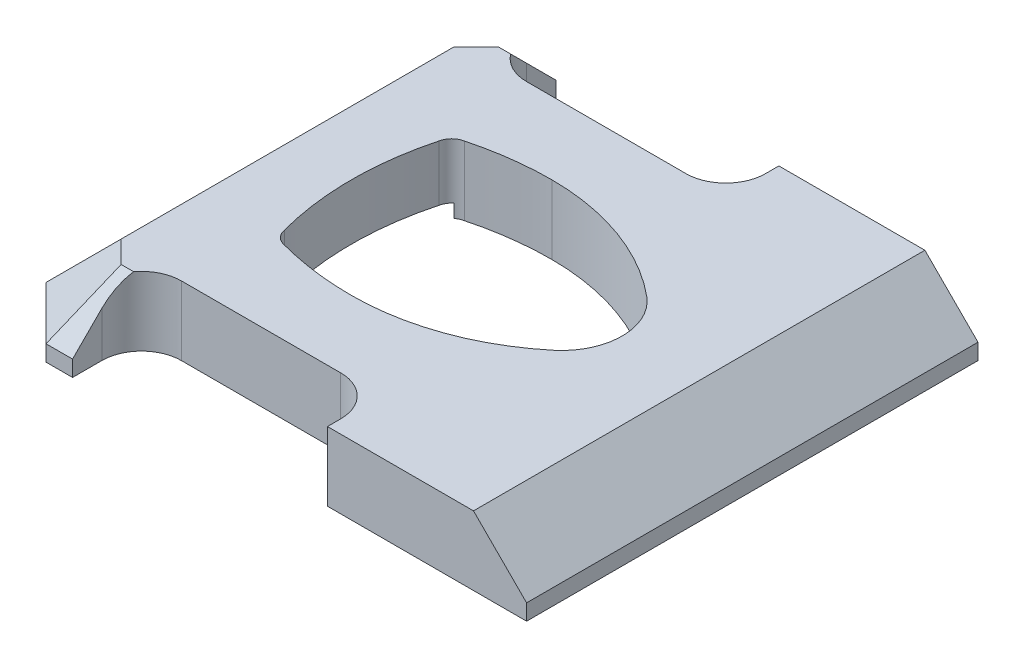
from build123d import *

# Parameters (mm, degrees)
SKETCH1_W           = 195
SKETCH1_H           = 170
BOSS_EXTRUDE1_DEPTH = 26
SKETCH2_W           = 90
SKETCH2_H           = 20
CUT_EXTRUDE1_DEPTH  = 132.936537775
FILLET1_R           = 15
SKETCH3_W           = 30
SKETCH3_H           = 6
BOSS_EXTRUDE2_DEPTH = 26
CHAMFER1_SIZE       = 20
CHAMFER2_SIZE       = 20
CHAMFER3_SIZE       = 20
SKETCH6_R           = 6.1
CUT_EXTRUDE4_DEPTH  = 3.2
FILLET2_R           = 0.2
CUT_EXTRUDE3_DEPTH  = 23
CUT_EXTRUDE5_DEPTH  = 136.879542242
SKETCH8_W           = 5
SKETCH8_H           = 76.6
BOSS_EXTRUDE3_DEPTH = 7
SKETCH9_W           = 10
SKETCH9_H           = 106.6
CUT_EXTRUDE6_DEPTH  = 5
SKETCH10_W          = 3
SKETCH10_H          = 106.6
CUT_EXTRUDE7_DEPTH  = 20
BOSS_EXTRUDE8_REACH = 166.014
SKETCH14_W          = 6
SKETCH14_H          = 16.5
CUT_EXTRUDE9_DEPTH  = 0.5
SKETCH15_W          = 5
SKETCH15_H          = 23.6
CUT_EXTRUDE10_DEPTH = 10
SKETCH16_W          = 20
SKETCH16_H          = 106.6
CUT_EXTRUDE11_DEPTH = 1


with BuildPart() as part:
    # Sketch1 → Boss-Extrude1 (new body)
    with BuildSketch(Plane(origin=(0, 0, 0), x_dir=(1, 0, 0), z_dir=(0, 1, 0))):
        Rectangle(SKETCH1_W, SKETCH1_H)
    extrude(amount=BOSS_EXTRUDE1_DEPTH)

    # Sketch2 → Cut-Extrude1 (cut, through all)
    with BuildSketch(Plane(origin=(0, 26, 0), x_dir=(1, 0, 0), z_dir=(0, 1, 0))):
        with Locations((-22.5, -75)):
            Rectangle(SKETCH2_W, SKETCH2_H)
        with Locations((-22.5, 75)):
            Rectangle(SKETCH2_W, SKETCH2_H)
    extrude(amount=-CUT_EXTRUDE1_DEPTH, mode=Mode.SUBTRACT)

    # Fillet1
    fillet1_edges = [part.edges().sort_by_distance(p)[0] for p in [
        (-67.5, 13, 65),
        (22.5, 13, 65),
        (-67.5, 13, -65),
        (22.5, 13, -65),
    ]]
    fillet(fillet1_edges, radius=FILLET1_R)

    # Sketch3 → Boss-Extrude2 (add)
    with BuildSketch(Plane(origin=(0, 26, 0), x_dir=(1, 0, 0), z_dir=(0, 1, 0))):
        with Locations((-82.5, 88)):
            Rectangle(SKETCH3_W, SKETCH3_H)
        with Locations((-82.5, -88)):
            Rectangle(SKETCH3_W, SKETCH3_H)
    extrude(amount=-BOSS_EXTRUDE2_DEPTH)

    # Chamfer1
    chamfer1_edges = [part.edges().sort_by_distance(p)[0] for p in [
        (-97.5, 13, -91),
        (-97.5, 13, 91),
    ]]
    chamfer(chamfer1_edges, length=CHAMFER1_SIZE)

    # Chamfer2
    chamfer2_edges = [part.edges().sort_by_distance(p)[0] for p in [
        (-72.5, 26, 91),
        (-72.5, 26, -91),
        (-97.5, 26, 0),
        (-87.5, 26, 81),
        (-87.5, 26, -81),
    ]]
    chamfer(chamfer2_edges, length=CHAMFER2_SIZE)

    # Chamfer3
    chamfer3_edges = [part.edges().sort_by_distance(p)[0] for p in [
        (97.5, 26, 0),
    ]]
    chamfer(chamfer3_edges, length=CHAMFER3_SIZE)

    # Sketch6 → Cut-Extrude4 (cut)
    with BuildSketch(Plane.XZ):
        with Locations(Location((82.166666667, -75, 0), (0, 0, 270))):
            Circle(SKETCH6_R)
        with Locations(Location((82.166666667, 75, 0), (0, 0, 90))):
            Circle(SKETCH6_R)
        with Locations(Location((-75.5, -79.6, 0), (0, 0, 270))):
            Circle(SKETCH6_R)
        with Locations(Location((-75.5, 79.6, 0), (0, 0, 90))):
            Circle(SKETCH6_R)
    extrude(amount=-CUT_EXTRUDE4_DEPTH, mode=Mode.SUBTRACT)

    # Fillet2
    fillet2_edges = [part.edges().sort_by_distance(p)[0] for p in [
        (82.166666667, 0, 68.9),
        (-75.5, 0, -73.5),
        (-75.5, 0, 73.5),
        (82.166666667, 0, -68.9),
    ]]
    fillet(fillet2_edges, radius=FILLET2_R)

    # Sketch5 → Cut-Extrude3 (cut)
    with BuildSketch(Plane.XZ):
        Polygon((-93.5, 38.3), (-77.5, 38.3), (-77.5, 53.3), (-57.5, 53.3), (-57.5, 38.3), (-57.5, -38.3), (-57.5, -53.3), (-77.5, -53.3), (-77.5, -38.3), (-93.5, -38.3), (-96.5, -38.3), (-96.5, -21.8), (-93.5, -21.8), (-77.5, -21.8), (-77.5, 21.8), (-93.5, 21.8), (-96.5, 21.8), (-96.5, 38.3), align=None)
    extrude(amount=-CUT_EXTRUDE3_DEPTH, mode=Mode.SUBTRACT)

    # Sketch7 → Cut-Extrude5 (cut, through all)
    with BuildSketch(Plane.XZ):
        with BuildLine():
            ThreePointArc((-45.328823714, -33.788550396), (-45.093019824, -33.847760063), (-44.855010797, -33.897368154))
            ThreePointArc((-44.855010797, -33.897368154), (-30.428224571, -36.76873565), (-15.749999998, -37.731354711))
            ThreePointArc((-15.749999998, -37.731354711), (14.040735516, -32.512701591), (40.283591791, -17.478249245))
            ThreePointArc((40.283591791, -17.478249245), (48.481354711, 0), (40.283591791, 17.478249245))
            ThreePointArc((40.283591791, 17.478249245), (14.040735515, 32.512701591), (-15.75, 37.731354711))
            ThreePointArc((-15.75, 37.731354711), (-30.428224573, 36.76873565), (-44.855010797, 33.897368153))
            ThreePointArc((-44.855010797, 33.897368153), (-45.093019823, 33.847760063), (-45.328823714, 33.788550395))
            ThreePointArc((-45.328823714, 33.788550395), (-47.992640687, 32.242640687), (-49.538550395, 29.578823714))
            ThreePointArc((-49.538550395, 29.578823714), (-49.597760063, 29.343019823), (-49.647368153, 29.105010797))
            ThreePointArc((-49.647368153, 29.105010797), (-53.481354711, 0), (-49.647368154, -29.105010797))
            ThreePointArc((-49.647368154, -29.105010797), (-49.597760063, -29.343019824), (-49.538550396, -29.578823714))
            ThreePointArc((-49.538550396, -29.578823714), (-47.992640687, -32.242640687), (-45.328823714, -33.788550396))
        make_face()
    extrude(amount=-CUT_EXTRUDE5_DEPTH, mode=Mode.SUBTRACT)

    # Sketch8 → Boss-Extrude3 (add)
    with BuildSketch(Plane.XZ):
        with Locations((-94, 0)):
            Rectangle(SKETCH8_W, SKETCH8_H)
    extrude(amount=-BOSS_EXTRUDE3_DEPTH)

    # Sketch9 → Cut-Extrude6 (cut)
    with BuildSketch(Plane.XZ):
        with Locations((-52.5, 0)):
            Rectangle(SKETCH9_W, SKETCH9_H)
    extrude(amount=-CUT_EXTRUDE6_DEPTH, mode=Mode.SUBTRACT)

    # Sketch10 → Cut-Extrude7 (cut)
    with BuildSketch(Plane.XZ):
        with Locations((-79, 0)):
            Rectangle(SKETCH10_W, SKETCH10_H)
    extrude(amount=-CUT_EXTRUDE7_DEPTH, mode=Mode.SUBTRACT)

    # Boss-Extrude8: up to this face of the body (flat: up to its plane)
    boss_extrude8_end = Plane(part.part.faces().sort_by_distance((-85.605919003, 9.540498442, -38.3))[0])
    # Sketch13 → Boss-Extrude8 (add, up to the picked face)
    with BuildSketch(Plane(origin=(0, 0, 38.3), x_dir=(-1, 0, 0), z_dir=(0, 0, -1)), mode=Mode.PRIVATE) as boss_extrude8_sk1:
        Polygon((80.5, 23), (77.5, 23), (77.5, 22), (81.5, 22), align=None)
    boss_extrude8_tool1 = split(extrude(boss_extrude8_sk1.sketch, amount=BOSS_EXTRUDE8_REACH, mode=Mode.PRIVATE), bisect_by=boss_extrude8_end, keep=Keep.BOTH, mode=Mode.PRIVATE)
    add(boss_extrude8_tool1.solids().sort_by(Axis((-79.261905, 22.47619, 38.3), (0, 0, -1)))[0])

    # Sketch14 → Cut-Extrude9 (cut)
    with BuildSketch(Plane(origin=(0, 7, 0), x_dir=(1, 0, 0), z_dir=(0, 1, 0))):
        with Locations((-94.5, 30.05)):
            Rectangle(SKETCH14_W, SKETCH14_H)
        with Locations((-94.5, -30.05)):
            Rectangle(SKETCH14_W, SKETCH14_H)
    extrude(amount=-CUT_EXTRUDE9_DEPTH, mode=Mode.SUBTRACT)

    # Sketch15 → Cut-Extrude10 (cut)
    with BuildSketch(Plane.XZ):
        with Locations((-83, 0)):
            Rectangle(SKETCH15_W, SKETCH15_H)
    extrude(amount=-CUT_EXTRUDE10_DEPTH, mode=Mode.SUBTRACT)

    # Sketch16 → Cut-Extrude11 (cut)
    with BuildSketch(Plane.XZ.offset(-23)):
        with Locations((-67.5, 0)):
            Rectangle(SKETCH16_W, SKETCH16_H)
    extrude(amount=-CUT_EXTRUDE11_DEPTH, mode=Mode.SUBTRACT)


solid = part.part
